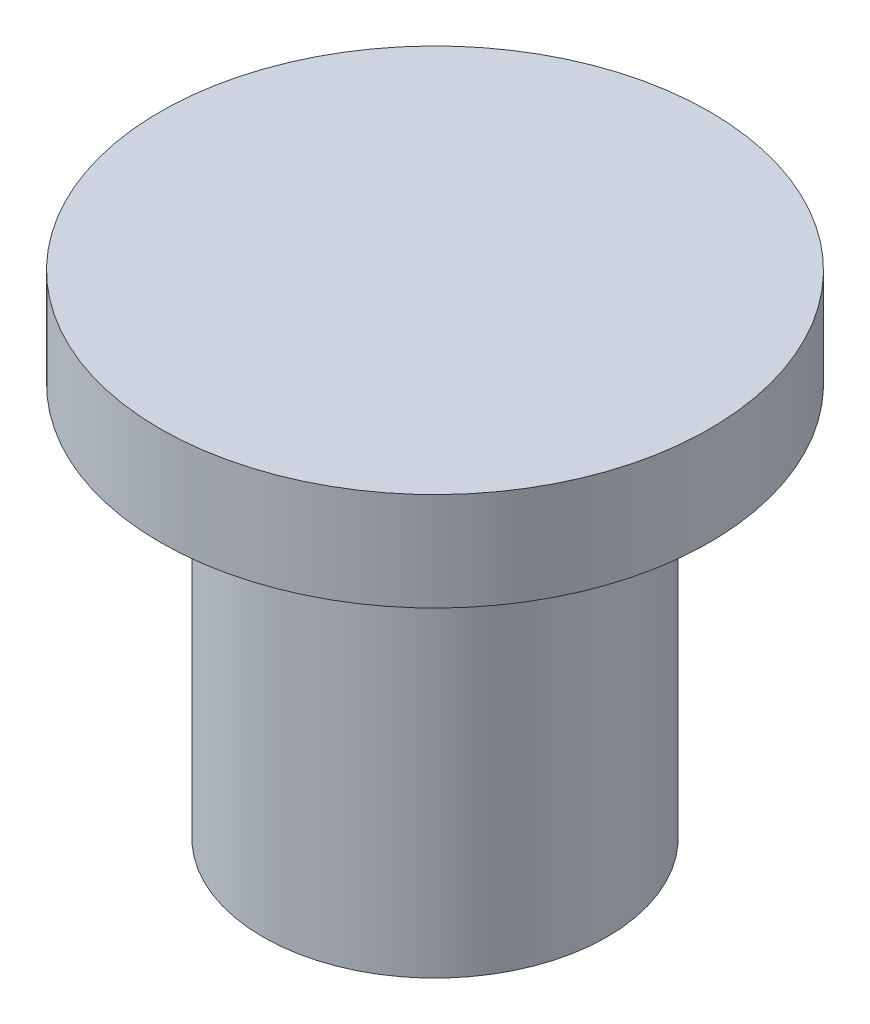
from build123d import *

# Parameters (mm, degrees)
ESQUISSE1_R        = 1.75
BOSS_EXTRU_1_DEPTH = 4
ESQUISSE2_R        = 2.79527767
BOSS_EXTRU_2_DEPTH = 1


with BuildPart() as part:
    # Esquisse1 → Boss.-Extru.1 (new body)
    with BuildSketch(Plane(origin=(0, 0, 0), x_dir=(1, 0, 0), z_dir=(0, 1, 0))):
        with Locations(Location((0, 0, 0), (0, 0, 270))):
            Circle(ESQUISSE1_R)
    extrude(amount=-BOSS_EXTRU_1_DEPTH)

    # Esquisse2 → Boss.-Extru.2 (add)
    with BuildSketch(Plane(origin=(0, 0, 0), x_dir=(1, 0, 0), z_dir=(0, 1, 0))):
        with Locations(Location((0, 0, 0), (0, 0, 270))):
            Circle(ESQUISSE2_R)
    extrude(amount=BOSS_EXTRU_2_DEPTH)


solid = part.part
